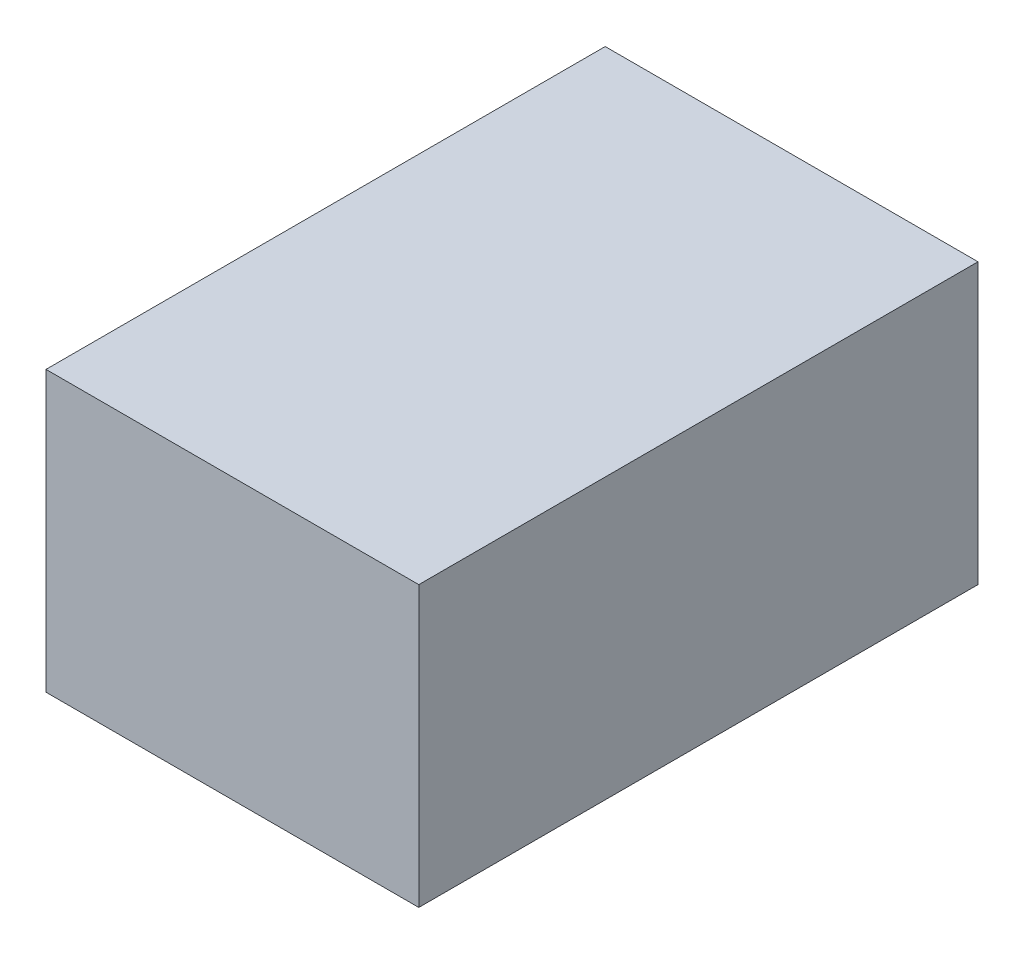
from build123d import *

# Parameters (mm, degrees)
SKETCH1_W           = 101.6
SKETCH1_H           = 152.4
BOSS_EXTRUDE1_DEPTH = 76.2


with BuildPart() as part:
    # Sketch1 → Boss-Extrude1 (new body)
    with BuildSketch(Plane(origin=(0, 0, 0), x_dir=(1, 0, 0), z_dir=(0, 1, 0))):
        Rectangle(SKETCH1_W, SKETCH1_H)
    extrude(amount=BOSS_EXTRUDE1_DEPTH)


solid = part.part
